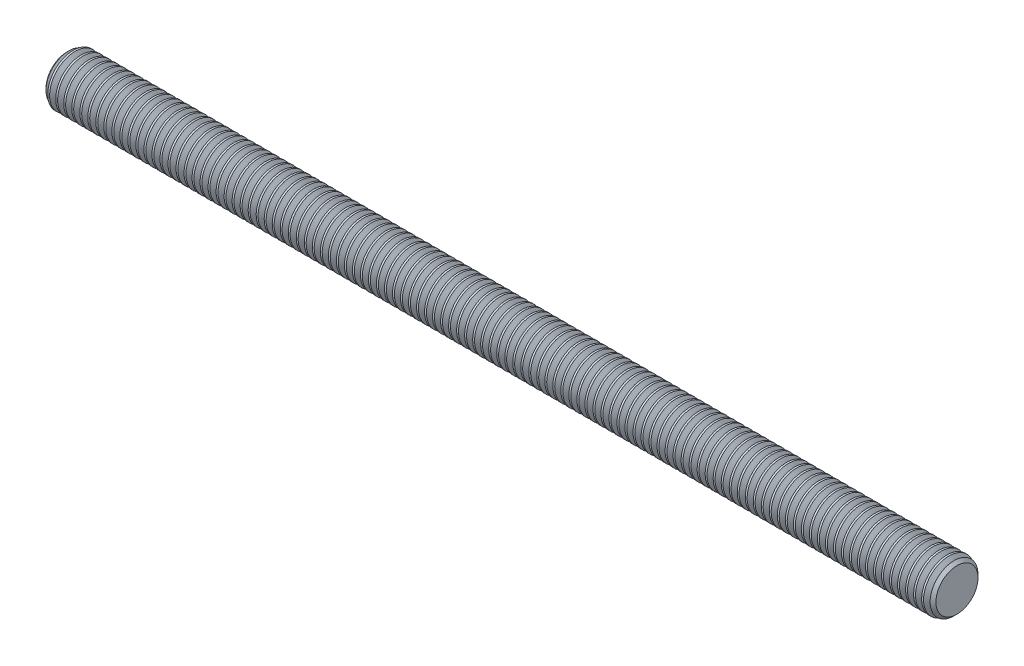
from build123d import *

# Parameters (mm, degrees)
BODYSKE_W       = 140
BODYSKE_H       = 4
CHAMFER1_SIZE   = 0.6905
THDSCHPAT_COUNT = 111
THDSCHPAT_PITCH = 1.261261261


with BuildPart() as part:
    # BodySke → BaseBody (revolve)
    with BuildSketch(Plane.XY, mode=Mode.PRIVATE) as basebody_sk:
        with Locations((70, 2)):
            Rectangle(BODYSKE_W, BODYSKE_H)
    revolve(basebody_sk.sketch.rotate(Axis((-3.175, 0, 0), (1, 0, 0)), 90), axis=Axis((-3.175, 0, 0), (1, 0, 0)))

    # Chamfer1
    chamfer1_edges = [part.edges().sort_by_distance(p)[0] for p in [
        (0, 0, -4),
        (140, 0, -4),
    ]]
    chamfer(chamfer1_edges, length=CHAMFER1_SIZE)

    # ThdSchSke → ThreadSchematic (revolve, cut)
    with BuildSketch(Plane.XY):
        Polygon((0.483493305, -3.3095), (0, -4), (0, -5), (0.96698661, -5), (0.96698661, -4), align=None)
    threadschematic = revolve(axis=Axis((-3.175, 0, 0), (1, 0, 0)), mode=Mode.SUBTRACT)

    # ThdSchPat: ThreadSchematic ×111
    with Locations(*[(i * THDSCHPAT_PITCH, 0, 0) for i in range(1, THDSCHPAT_COUNT)]):
        add(threadschematic, mode=Mode.SUBTRACT)


solid = part.part
